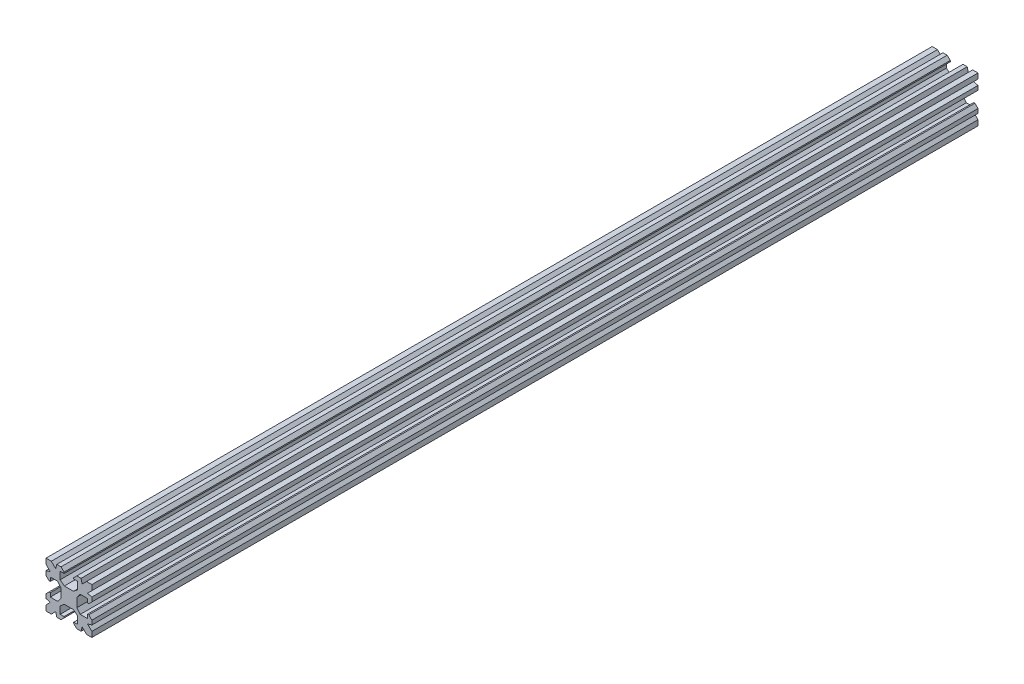
from build123d import *

# Parameters (mm, degrees)
EXTRUDE_1_DEPTH     = 290
CUT_EXTRUDE_1_DEPTH = 291.193900694
CHAMFER_1_SIZE      = 1


with BuildPart() as part:
    # Эскиз1 → Бобышка-Вытянуть1 (new body)
    with BuildSketch(Plane.XY):
        Polygon((1.58, 7.5), (1.58, 6.1), (2.85, 6.1), (2.85, 3.7), (-2.85, 3.7), (-2.85, 6.1), (-1.58, 6.1), (-1.58, 7.5), (-3.962017091, 7.5), (-4.342017091, 6.08), (-5.762017091, 7.5), (-7.5, 7.5), (-7.5, 5.762017091), (-6.08, 4.342017091), (-7.5, 3.962017091), (-7.5, 1.58), (-6.1, 1.58), (-6.1, 2.85), (-3.7, 2.85), (-3.7, -2.85), (-6.1, -2.85), (-6.1, -1.58), (-7.5, -1.58), (-7.5, -3.962017091), (-6.08, -4.342017091), (-7.5, -5.762017091), (-7.5, -7.5), (-5.762017091, -7.5), (-4.342017091, -6.08), (-3.962017091, -7.5), (-1.58, -7.5), (-1.58, -6.1), (-2.85, -6.1), (-2.85, -3.7), (2.85, -3.7), (2.85, -6.1), (1.58, -6.1), (1.58, -7.5), (3.962017091, -7.5), (4.342017091, -6.08), (5.762017091, -7.5), (7.5, -7.5), (7.5, -5.762017091), (6.08, -4.342017091), (7.5, -3.962017091), (7.5, -1.58), (6.1, -1.58), (6.1, -2.85), (3.7, -2.85), (3.7, 2.85), (6.1, 2.85), (6.1, 1.58), (7.5, 1.58), (7.5, 3.962017091), (6.08, 4.342017091), (7.5, 5.762017091), (7.5, 7.5), (5.762017091, 7.5), (4.342017091, 6.08), (3.962017091, 7.5), align=None)
    extrude(amount=EXTRUDE_1_DEPTH)

    # Эскиз2 → Вырез-Вытянуть1 (cut, through all)
    with BuildSketch(Plane.XY.offset(290)):
        Polygon((-3.7, 2.85), (-2.6, 1.5), (-2.6, -1.5), (-3.7, -2.85), align=None)
        Polygon((2.85, 3.7), (1.5, 2.6), (-1.5, 2.6), (-2.85, 3.7), align=None)
        Polygon((3.7, -2.85), (2.6, -1.5), (2.6, 1.5), (3.7, 2.85), align=None)
        Polygon((-2.85, -3.7), (-1.5, -2.6), (1.5, -2.6), (2.85, -3.7), align=None)
    extrude(amount=-CUT_EXTRUDE_1_DEPTH, mode=Mode.SUBTRACT)

    # Фаска1
    chamfer_1_edges = [part.edges().sort_by_distance(p)[0] for p in [
        (-7.5, -1.58, 145),
        (-7.5, 1.58, 145),
        (-1.58, 7.5, 145),
        (1.58, 7.5, 145),
        (7.5, 1.58, 145),
        (7.5, -1.58, 145),
        (1.58, -7.5, 145),
        (-1.58, -7.5, 145),
    ]]
    chamfer(chamfer_1_edges, length=CHAMFER_1_SIZE)


solid = part.part
